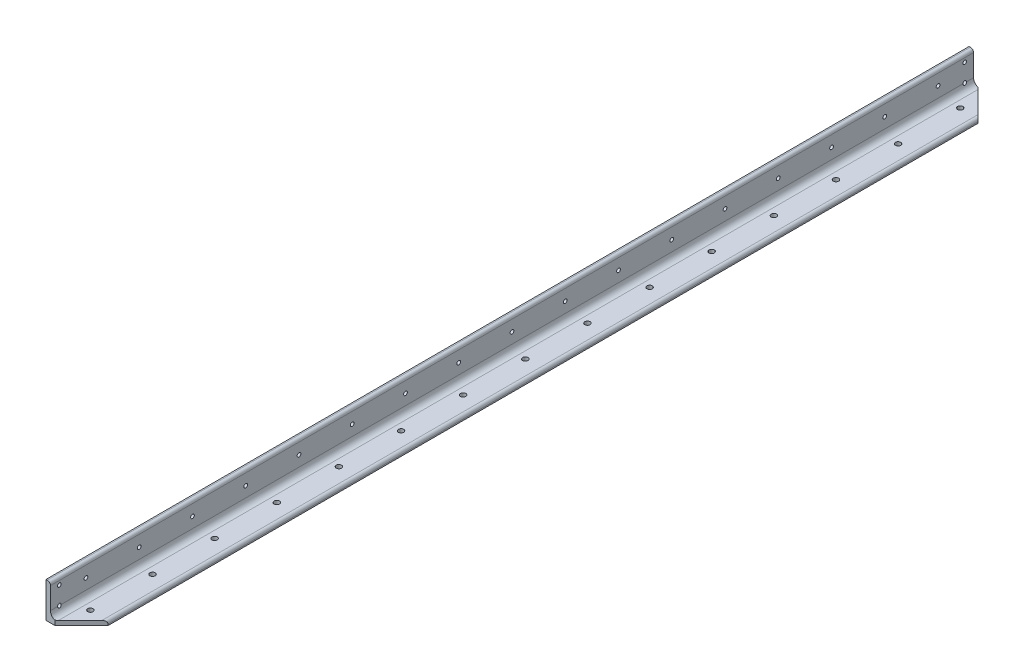
from build123d import *

# Parameters (mm, degrees)
AUFSATZ_LINEAR_AUSTRAGEN1_DEPTH      = 1040
SCHNITT_LINEAR_AUSTRAGEN1_DEPTH      = 10
SCHNITT_LINEAR_AUSTRAGEN1_DEPTH_BACK = 10
SKIZZE3_R                            = 3
SCHNITT_LINEAR_AUSTRAGEN2_DEPTH      = 10
LINEARES_MUSTER1_COUNT               = 15
LINEARES_MUSTER1_PITCH               = 70
LINEARES_MUSTER2_COUNT               = 17
LINEARES_MUSTER2_PITCH               = 60
M5_GEWINDEBOHRUNG2_D                 = 4.2
M5_GEWINDEBOHRUNG2_DEPTH             = 14
M5_GEWINDEBOHRUNG2_TIP               = 1.2618073


with BuildPart() as part:
    # Skizze1 → Aufsatz-Linear austragen1 (new body)
    with BuildSketch(Plane.XY):
        with BuildLine():
            Line((0, 40), (0, 0))
            Line((0, 0), (40, 0))
            Line((40, 0), (40, 1.5))
            ThreePointArc((40, 1.5), (38.974873734, 3.974873734), (36.5, 5))
            Line((36.5, 5), (12, 5))
            ThreePointArc((12, 5), (7.050252532, 7.050252532), (5, 12))
            Line((5, 12), (5, 36.5))
            ThreePointArc((5, 36.5), (3.974873734, 38.974873734), (1.5, 40))
            Line((1.5, 40), (0, 40))
        make_face()
    extrude(amount=AUFSATZ_LINEAR_AUSTRAGEN1_DEPTH)

    # Skizze2 → Schnitt-Linear austragen1 (cut, two sides: drawn at the far end of the back side and taken through both)
    with BuildSketch(Plane(origin=(0, 5, 0), x_dir=(1, 0, 0), z_dir=(0, 1, 0)).offset(-SCHNITT_LINEAR_AUSTRAGEN1_DEPTH_BACK)):
        Polygon((10, -1040), (40, -1010), (40, -1040), align=None)
        Polygon((10, 0), (40, -30), (40, 0), align=None)
    extrude(amount=SCHNITT_LINEAR_AUSTRAGEN1_DEPTH + SCHNITT_LINEAR_AUSTRAGEN1_DEPTH_BACK, mode=Mode.SUBTRACT)

    # Skizze3 → Schnitt-Linear austragen2 (cut)
    with BuildSketch(Plane(origin=(0, 5, 0), x_dir=(1, 0, 0), z_dir=(0, 1, 0))):
        with Locations(Location((20, -30, 0), (0, 0, 180))):
            Circle(SKIZZE3_R)
    schnitt_linear_austragen2 = extrude(amount=-SCHNITT_LINEAR_AUSTRAGEN2_DEPTH, mode=Mode.SUBTRACT)

    # Lineares Muster1: Schnitt-Linear austragen2 ×15
    with Locations(*[(0, 0, i * LINEARES_MUSTER1_PITCH) for i in range(1, LINEARES_MUSTER1_COUNT)]):
        add(schnitt_linear_austragen2, mode=Mode.SUBTRACT)

    # Skizze5 → M5 Gewindebohrung1 (revolve, cut)
    with BuildSketch(Plane(origin=(0, 24, 1000), x_dir=(0, 0, 1), z_dir=(0, 1, 0))):
        Polygon((0, 0), (0, 15.2618073), (2.1, 14), (2.1, 0), align=None)
    m5_gewindebohrung1 = revolve(axis=Axis((-6.35, 24, 1000), (1, 0, 0)), mode=Mode.SUBTRACT)

    # Lineares Muster2: M5 Gewindebohrung1 ×17
    with Locations(*[(0, 0, -i * LINEARES_MUSTER2_PITCH) for i in range(1, LINEARES_MUSTER2_COUNT)]):
        add(m5_gewindebohrung1, mode=Mode.SUBTRACT)

    # M5 Gewindebohrung2
    with Locations(Plane.ZY):
        with Locations((10, 32), (1030, 12), (1030, 32), (10, 12)):
            Hole(M5_GEWINDEBOHRUNG2_D / 2, depth=M5_GEWINDEBOHRUNG2_DEPTH)
            with Locations((0, 0, -(M5_GEWINDEBOHRUNG2_DEPTH + M5_GEWINDEBOHRUNG2_TIP / 2))):  # 118° drill point
                Cone(0, M5_GEWINDEBOHRUNG2_D / 2, M5_GEWINDEBOHRUNG2_TIP, mode=Mode.SUBTRACT)


solid = part.part
